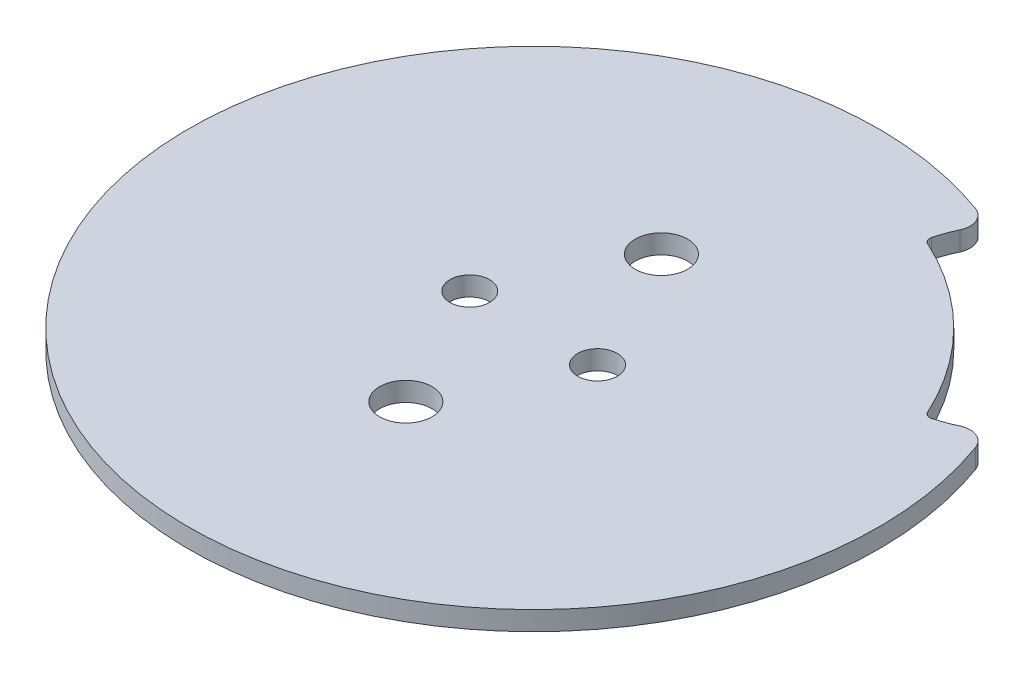
from build123d import *

# Parameters (mm, degrees)
SKETCH1_R           = 3.1
SKETCH1_R_2         = 4.1
BOSS_EXTRUDE1_DEPTH = 3
FILLET1_R           = 3
FILLET2_R           = 1


with BuildPart() as part:
    # Sketch1 → Boss-Extrude1 (new body)
    with BuildSketch(Plane(origin=(0, 0, 0), x_dir=(1, 0, 0), z_dir=(0, 1, 0))):
        with BuildLine():
            ThreePointArc((21.667324002, 49.462380357), (-38.183766184, -38.183766184), (49.462380357, 21.667324002))
            ThreePointArc((49.462380357, 21.667324002), (46.165505457, 19.845504593), (42.585510083, 18.674162122))
            ThreePointArc((42.585510083, 18.674162122), (32.880465325, 32.880465325), (18.674162122, 42.585510083))
            ThreePointArc((18.674162122, 42.585510083), (19.845504593, 46.165505457), (21.667324002, 49.462380357))
        make_face()
        with Locations(Location((10, 0, 0), (0, 0, 270))):
            Circle(SKETCH1_R, mode=Mode.SUBTRACT)
        with Locations(Location((0, 20, 0), (0, 0, 270))):
            Circle(SKETCH1_R_2, mode=Mode.SUBTRACT)
        with Locations(Location((0, -20, 0), (0, 0, 270))):
            Circle(SKETCH1_R_2, mode=Mode.SUBTRACT)
        with Locations(Location((-10, 0, 0), (0, 0, 270))):
            Circle(SKETCH1_R, mode=Mode.SUBTRACT)
    extrude(amount=BOSS_EXTRUDE1_DEPTH)

    # Fillet1
    fillet1_edges = [part.edges().sort_by_distance(p)[0] for p in [
        (49.462380357, 1.5, -21.667324002),
        (21.667324002, 1.5, -49.462380357),
    ]]
    fillet(fillet1_edges, radius=FILLET1_R)

    # Fillet2
    fillet2_edges = [part.edges().sort_by_distance(p)[0] for p in [
        (18.674162122, 1.5, -42.585510083),
        (42.585510083, 1.5, -18.674162122),
    ]]
    fillet(fillet2_edges, radius=FILLET2_R)


solid = part.part
